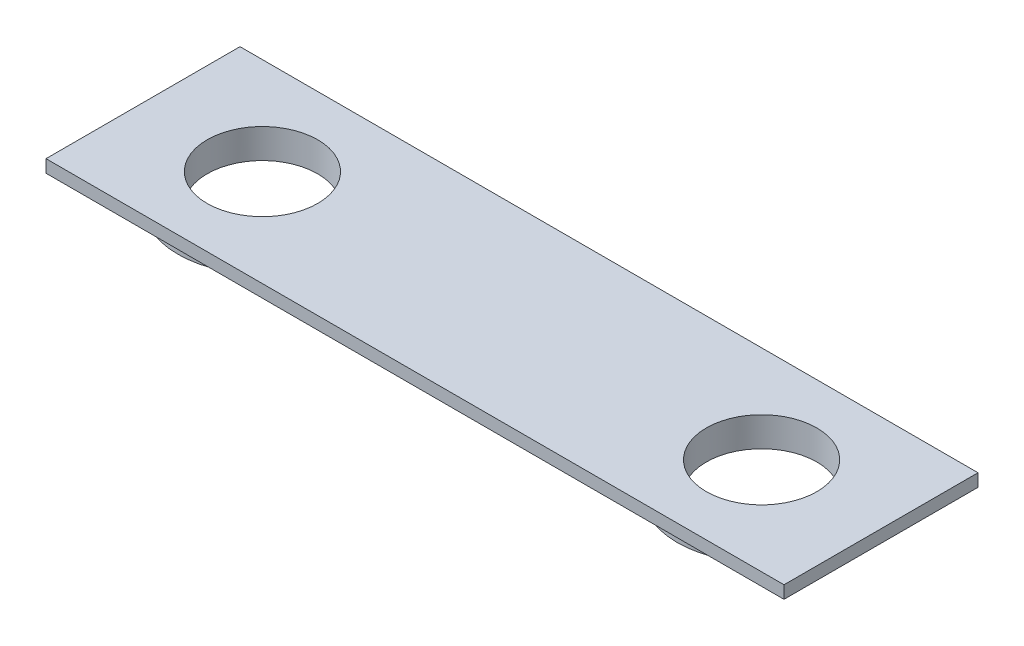
from build123d import *

# Parameters (mm, degrees)
SKETCH1_W           = 87.5
SKETCH1_H           = 23
SKETCH1_R           = 6.55
BOSS_EXTRUDE1_DEPTH = 1.5
BOSS_EXTRUDE2_START = 2
SKETCH2_R           = 10
SKETCH2_R_2         = 6.55
BOSS_EXTRUDE2_DEPTH = 2


with BuildPart() as part:
    # Sketch1 → Boss-Extrude1 (new body)
    with BuildSketch(Plane(origin=(0, 0, 0), x_dir=(1, 0, 0), z_dir=(0, 1, 0))):
        Rectangle(SKETCH1_W, SKETCH1_H)
        with Locations((-29.591, 0)):
            Circle(SKETCH1_R, mode=Mode.SUBTRACT)
        with Locations((29.591, 0)):
            Circle(SKETCH1_R, mode=Mode.SUBTRACT)
    extrude(amount=BOSS_EXTRUDE1_DEPTH)

    # Sketch2 → Boss-Extrude2 (add)
    # profile 1 of 2: a face of its own
    with BuildSketch(Plane.XZ.offset(BOSS_EXTRUDE2_START)):
        with Locations((-29.591, 0)):
            Circle(SKETCH2_R)
        with Locations((-29.591, 0)):
            Circle(SKETCH2_R_2, mode=Mode.SUBTRACT)
    # profile 2 of 2: a face of its own
    with BuildSketch(Plane.XZ.offset(BOSS_EXTRUDE2_START)):
        with Locations((29.591, 0)):
            Circle(SKETCH2_R)
        with Locations((29.591, 0)):
            Circle(SKETCH2_R_2, mode=Mode.SUBTRACT)
    extrude(amount=-BOSS_EXTRUDE2_DEPTH)


solid = part.part
